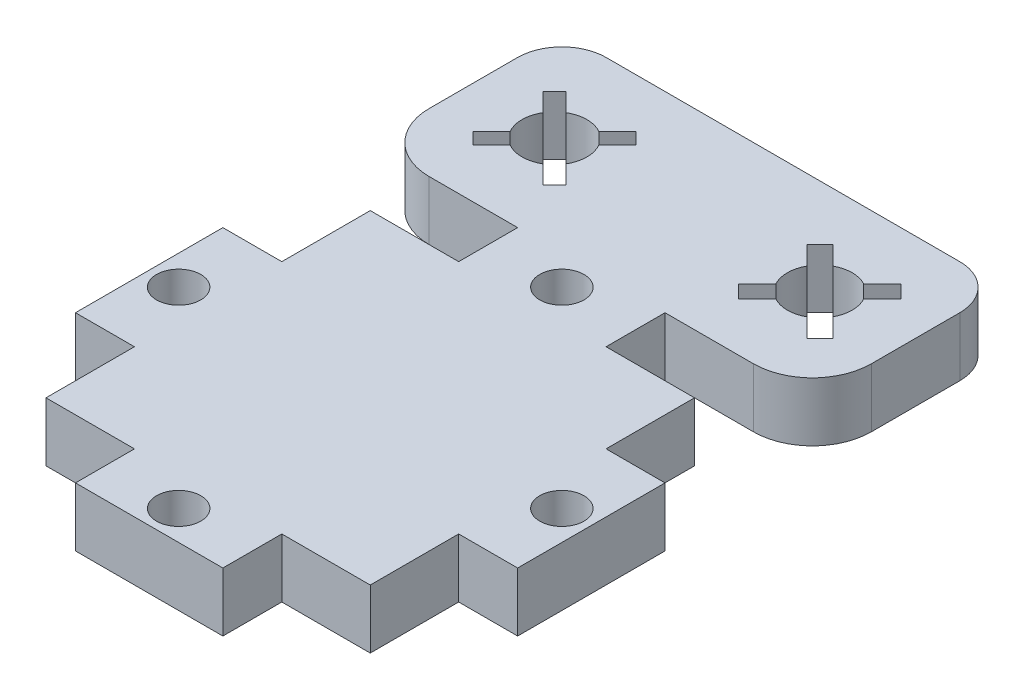
from build123d import *

# Parameters (mm, degrees)
BOSS_EXTRUDE1_DEPTH = 4
SKETCH3_W           = 30
SKETCH3_H           = 4
BOSS_EXTRUDE2_DEPTH = 13
CUT_EXTRUDE2_DEPTH  = 10
FILLET1_R           = 3
FILLET2_R           = 4
SKETCH6_R           = 1.5
CUT_EXTRUDE3_DEPTH  = 10


with BuildPart() as part:
    # Sketch1 → Boss-Extrude1 (new body)
    with BuildSketch(Plane(origin=(0, 0, 0), x_dir=(1, 0, 0), z_dir=(0, 1, 0))):
        Polygon((10, 4), (10, 0), (20, 0), (20, 4), (26, 4), (26, 10), (30, 10), (30, 20), (26, 20), (26, 26), (20, 26), (20, 30), (10, 30), (10, 26), (4, 26), (4, 20), (0, 20), (0, 10), (4, 10), (4, 4), align=None)
    extrude(amount=BOSS_EXTRUDE1_DEPTH)

    # Sketch3 → Boss-Extrude2 (add)
    with BuildSketch(Plane(origin=(0, 0, -30), x_dir=(-1, 0, 0), z_dir=(0, 0, -1))):
        with Locations((-15, 2)):
            Rectangle(SKETCH3_W, SKETCH3_H)
    extrude(amount=BOSS_EXTRUDE2_DEPTH)

    # Sketch4 → Cut-Extrude2 (cut)
    with BuildSketch(Plane(origin=(0, 4, 0), x_dir=(1, 0, 0), z_dir=(0, 1, 0))):
        with BuildLine():
            Line((7.895145763, 37.617328303), (9.146625176, 38.868807717))
            Line((9.146625176, 38.868807717), (8.368807717, 39.646625176))
            Line((8.368807717, 39.646625176), (7.117328303, 38.395145763))
            ThreePointArc((7.117328303, 38.395145763), (6, 38.7), (4.882671697, 38.395145763))
            Line((4.882671697, 38.395145763), (3.631192283, 39.646625176))
            Line((3.631192283, 39.646625176), (2.853374824, 38.868807717))
            Line((2.853374824, 38.868807717), (4.104854237, 37.617328303))
            ThreePointArc((4.104854237, 37.617328303), (3.8, 36.5), (4.104854237, 35.382671697))
            Line((4.104854237, 35.382671697), (2.853374824, 34.131192283))
            Line((2.853374824, 34.131192283), (3.631192283, 33.353374824))
            Line((3.631192283, 33.353374824), (4.882671697, 34.604854237))
            ThreePointArc((4.882671697, 34.604854237), (6, 34.3), (7.117328303, 34.604854237))
            Line((7.117328303, 34.604854237), (8.368807717, 33.353374824))
            Line((8.368807717, 33.353374824), (9.146625176, 34.131192283))
            Line((9.146625176, 34.131192283), (7.895145763, 35.382671697))
            ThreePointArc((7.895145763, 35.382671697), (8.2, 36.5), (7.895145763, 37.617328303))
        make_face()
        with BuildLine():
            Line((22.950403103, 38.433480373), (21.684225292, 39.699658185))
            Line((21.684225292, 39.699658185), (20.800341815, 38.815774708))
            Line((20.800341815, 38.815774708), (22.066519627, 37.549596897))
            ThreePointArc((22.066519627, 37.549596897), (21.8, 36.5), (22.066519627, 35.450403103))
            Line((22.066519627, 35.450403103), (20.800341815, 34.184225292))
            Line((20.800341815, 34.184225292), (21.684225292, 33.300341815))
            Line((21.684225292, 33.300341815), (22.950403103, 34.566519627))
            ThreePointArc((22.950403103, 34.566519627), (24, 34.3), (25.049596897, 34.566519627))
            Line((25.049596897, 34.566519627), (26.315774708, 33.300341815))
            Line((26.315774708, 33.300341815), (27.199658185, 34.184225292))
            Line((27.199658185, 34.184225292), (25.933480373, 35.450403103))
            ThreePointArc((25.933480373, 35.450403103), (26.2, 36.5), (25.933480373, 37.549596897))
            Line((25.933480373, 37.549596897), (27.199658185, 38.815774708))
            Line((27.199658185, 38.815774708), (26.315774708, 39.699658185))
            Line((26.315774708, 39.699658185), (25.049596897, 38.433480373))
            ThreePointArc((25.049596897, 38.433480373), (24, 38.7), (22.950403103, 38.433480373))
        make_face()
    extrude(amount=-CUT_EXTRUDE2_DEPTH, mode=Mode.SUBTRACT)

    # Fillet1
    fillet1_edges = [part.edges().sort_by_distance(p)[0] for p in [
        (0, 2, -43),
        (30, 2, -43),
    ]]
    fillet(fillet1_edges, radius=FILLET1_R)

    # Fillet2
    fillet2_edges = [part.edges().sort_by_distance(p)[0] for p in [
        (0, 2, -30),
        (30, 2, -30),
    ]]
    fillet(fillet2_edges, radius=FILLET2_R)

    # Sketch6 → Cut-Extrude3 (cut)
    with BuildSketch(Plane(origin=(0, 4, 0), x_dir=(1, 0, 0), z_dir=(0, 1, 0))):
        with Locations((28, 15)):
            Circle(SKETCH6_R)
        with Locations((15, 2)):
            Circle(SKETCH6_R)
        with Locations((2, 15)):
            Circle(SKETCH6_R)
        with Locations((15, 28)):
            Circle(SKETCH6_R)
    extrude(amount=-CUT_EXTRUDE3_DEPTH, mode=Mode.SUBTRACT)


solid = part.part
